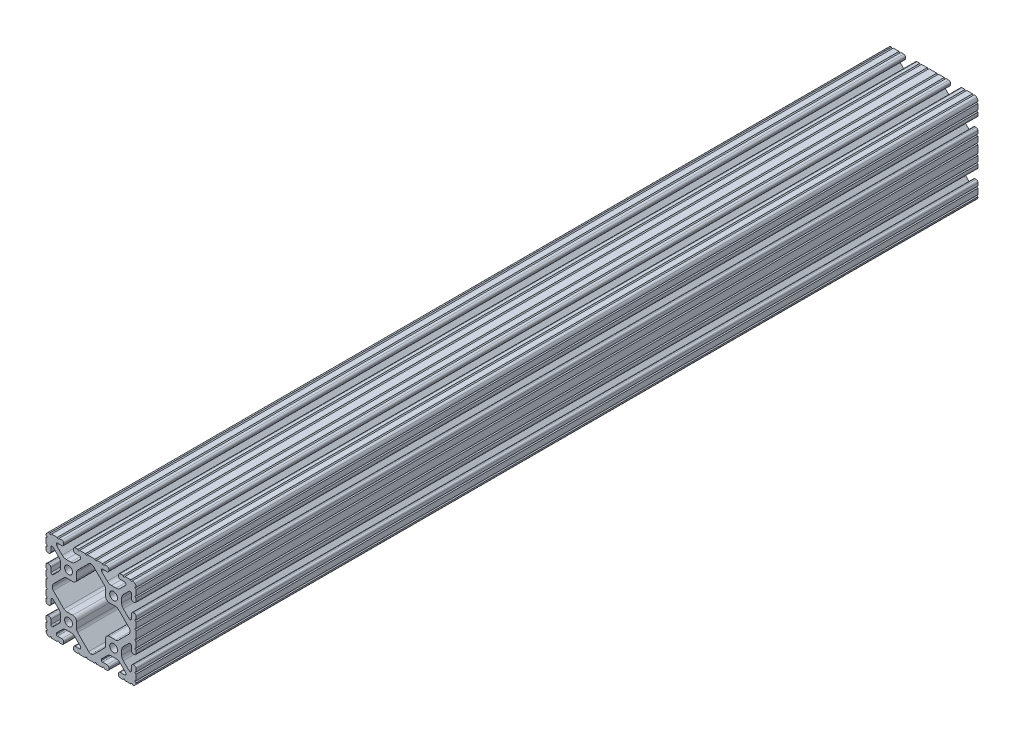
from build123d import *

# Parameters (mm, degrees)
BOSS_EXTRUDE1_DEPTH      = 355.6
BOSS_EXTRUDE1_DEPTH_BACK = 355.6
SKETCH3_R                = 3.3274


with BuildPart() as part:
    # Sketch3 → Boss-Extrude1 (new, two sides: drawn at the far end of the back side and taken through both)
    with BuildSketch(Plane.XY.offset(-BOSS_EXTRUDE1_DEPTH_BACK)):
        with BuildLine():
            Line((34.036, 28.448), (34.036, 24.630196049))
            ThreePointArc((34.036, 24.630196049), (34.497248241, 23.51664429), (35.6108, 23.055396049))
            Line((35.6108, 23.055396049), (36.525200183, 23.055396049))
            ThreePointArc((36.525200183, 23.055396049), (37.638751813, 23.516644236), (38.1, 24.630195866))
            Line((38.1, 24.630195866), (38.1, 27.023826138))
            ThreePointArc((38.1, 27.023826138), (37.117780706, 27.7845421), (38.1, 28.545258062))
            Line((38.1, 28.545258062), (38.1, 33.373016026))
            ThreePointArc((38.1, 33.373016026), (37.141472621, 34.109236774), (38.1, 34.845457521))
            ThreePointArc((38.1, 34.845457521), (37.837757813, 36.120195002), (37.086123144, 37.182631793))
            ThreePointArc((37.086123144, 37.182631793), (36.106286572, 37.843374398), (34.952681874, 38.1))
            ThreePointArc((34.952681874, 38.1), (34.190730434, 37.320215335), (33.428778994, 38.1))
            Line((33.428778994, 38.1), (28.601105935, 38.1))
            ThreePointArc((28.601105935, 38.1), (27.839158581, 37.32021942), (27.077211227, 38.1))
            Line((27.077211227, 38.1), (24.6888, 38.1))
            ThreePointArc((24.6888, 38.1), (23.575248241, 37.638751759), (23.114, 36.5252))
            Line((23.114, 36.5252), (23.114, 35.6108))
            ThreePointArc((23.114, 35.6108), (23.575248241, 34.497248241), (24.6888, 34.036))
            Line((24.6888, 34.036), (28.448, 34.036))
            ThreePointArc((28.448, 34.036), (29.076617928, 33.775617928), (29.337, 33.147))
            Line((29.337, 33.147), (29.337, 32.720693454))
            ThreePointArc((29.337, 32.720693454), (29.326675076, 32.273872751), (29.100231244, 31.888543625))
            Line((29.100231244, 31.888543625), (24.409287499, 27.197588341))
            ThreePointArc((24.409287499, 27.197588341), (22.868340045, 26.167958114), (21.050667579, 25.8064))
            Line((21.050667579, 25.8064), (17.049332421, 25.8064))
            ThreePointArc((17.049332421, 25.8064), (15.231659955, 26.167958114), (13.690712501, 27.197588341))
            Line((13.690712501, 27.197588341), (9.023381298, 31.864931024))
            ThreePointArc((9.023381298, 31.864931024), (8.830670886, 32.153343113), (8.763, 32.493548179))
            Line((8.763, 32.493548179), (8.763, 33.147))
            ThreePointArc((8.763, 33.147), (9.023382072, 33.775617928), (9.652, 34.036))
            Line((9.652, 34.036), (13.4112, 34.036))
            ThreePointArc((13.4112, 34.036), (14.524751759, 34.497248241), (14.986, 35.6108))
            Line((14.986, 35.6108), (14.986, 36.5252))
            ThreePointArc((14.986, 36.5252), (14.524751759, 37.638751759), (13.4112, 38.1))
            Line((13.4112, 38.1), (11.128867074, 38.1))
            ThreePointArc((11.128867074, 38.1), (10.367071033, 37.320370693), (9.605274992, 38.1))
            Line((9.605274992, 38.1), (4.777313069, 38.1))
            ThreePointArc((4.777313069, 38.1), (4.015517029, 37.320370693), (3.253720988, 38.1))
            Line((3.253720988, 38.1), (-3.253720988, 38.1))
            ThreePointArc((-3.253720988, 38.1), (-4.015517029, 37.320370693), (-4.777313069, 38.1))
            Line((-4.777313069, 38.1), (-9.605274992, 38.1))
            ThreePointArc((-9.605274992, 38.1), (-10.367071033, 37.320370693), (-11.128867074, 38.1))
            Line((-11.128867074, 38.1), (-13.4112, 38.1))
            ThreePointArc((-13.4112, 38.1), (-14.524751759, 37.638751759), (-14.986, 36.5252))
            Line((-14.986, 36.5252), (-14.986, 35.6108))
            ThreePointArc((-14.986, 35.6108), (-14.524751759, 34.497248241), (-13.4112, 34.036))
            Line((-13.4112, 34.036), (-9.652, 34.036))
            ThreePointArc((-9.652, 34.036), (-9.023382072, 33.775617928), (-8.763, 33.147))
            Line((-8.763, 33.147), (-8.763, 32.493548179))
            ThreePointArc((-8.763, 32.493548179), (-8.830670886, 32.153343113), (-9.023381298, 31.864931024))
            Line((-9.023381298, 31.864931024), (-13.690712501, 27.197588341))
            ThreePointArc((-13.690712501, 27.197588341), (-15.231659955, 26.167958114), (-17.049332421, 25.8064))
            Line((-17.049332421, 25.8064), (-21.050667579, 25.8064))
            ThreePointArc((-21.050667579, 25.8064), (-22.868340045, 26.167958114), (-24.409287499, 27.197588341))
            Line((-24.409287499, 27.197588341), (-29.100231244, 31.888543625))
            ThreePointArc((-29.100231244, 31.888543625), (-29.326675076, 32.273872751), (-29.337, 32.720693454))
            Line((-29.337, 32.720693454), (-29.337, 33.147))
            ThreePointArc((-29.337, 33.147), (-29.076617928, 33.775617928), (-28.448, 34.036))
            Line((-28.448, 34.036), (-24.6888, 34.036))
            ThreePointArc((-24.6888, 34.036), (-23.575248241, 34.497248241), (-23.114, 35.6108))
            Line((-23.114, 35.6108), (-23.114, 36.5252))
            ThreePointArc((-23.114, 36.5252), (-23.575248241, 37.638751759), (-24.6888, 38.1))
            Line((-24.6888, 38.1), (-27.077211227, 38.1))
            ThreePointArc((-27.077211227, 38.1), (-27.839158581, 37.32021942), (-28.601105935, 38.1))
            Line((-28.601105935, 38.1), (-33.428778994, 38.1))
            ThreePointArc((-33.428778994, 38.1), (-34.190730434, 37.320215335), (-34.952681874, 38.1))
            ThreePointArc((-34.952681874, 38.1), (-36.106286572, 37.843374398), (-37.086123144, 37.182631793))
            ThreePointArc((-37.086123144, 37.182631793), (-37.837757813, 36.120195002), (-38.1, 34.845457521))
            ThreePointArc((-38.1, 34.845457521), (-37.141472621, 34.109236774), (-38.1, 33.373016026))
            Line((-38.1, 33.373016026), (-38.1, 28.545258062))
            ThreePointArc((-38.1, 28.545258062), (-37.117780706, 27.7845421), (-38.1, 27.023826138))
            Line((-38.1, 27.023826138), (-38.1, 24.630195866))
            ThreePointArc((-38.1, 24.630195866), (-37.638751813, 23.516644236), (-36.525200183, 23.055396049))
            Line((-36.525200183, 23.055396049), (-35.6108, 23.055396049))
            ThreePointArc((-35.6108, 23.055396049), (-34.497248241, 23.51664429), (-34.036, 24.630196049))
            Line((-34.036, 24.630196049), (-34.036, 28.448))
            ThreePointArc((-34.036, 28.448), (-33.775617928, 29.076617928), (-33.147, 29.337))
            Line((-33.147, 29.337), (-32.664287242, 29.337))
            ThreePointArc((-32.664287242, 29.337), (-32.324081166, 29.269328695), (-32.03566854, 29.076617155))
            Line((-32.03566854, 29.076617155), (-27.19758008, 24.238516795))
            ThreePointArc((-27.19758008, 24.238516795), (-26.167955879, 22.697572205), (-25.8064, 20.879905136))
            Line((-25.8064, 20.879905136), (-25.8064, 17.220094864))
            ThreePointArc((-25.8064, 17.220094864), (-26.167955879, 15.402427795), (-27.19758008, 13.861483205))
            Line((-27.19758008, 13.861483205), (-31.948944541, 9.110107057))
            ThreePointArc((-31.948944541, 9.110107057), (-32.333417096, 8.853210196), (-32.786933649, 8.763))
            Line((-32.786933649, 8.763), (-33.060275787, 8.763))
            ThreePointArc((-33.060275787, 8.763), (-33.750216995, 9.048783005), (-34.036, 9.738724213))
            Line((-34.036, 9.738724213), (-34.036, 13.469803585))
            ThreePointArc((-34.036, 13.469803585), (-34.497248348, 14.583355603), (-35.610800366, 15.044603951))
            Line((-35.610800366, 15.044603951), (-36.5252, 15.044603951))
            ThreePointArc((-36.5252, 15.044603951), (-37.638751759, 14.58335571), (-38.1, 13.469803951))
            Line((-38.1, 13.469803951), (-38.1, 11.075039289))
            ThreePointArc((-38.1, 11.075039289), (-37.117000248, 10.313517272), (-38.1, 9.551995255))
            Line((-38.1, 9.551995255), (-38.1, 4.723759308))
            ThreePointArc((-38.1, 4.723759308), (-37.117000248, 3.962237292), (-38.1, 3.200715275))
            Line((-38.1, 3.200715275), (-38.1, -3.200715275))
            ThreePointArc((-38.1, -3.200715275), (-37.117000248, -3.962237292), (-38.1, -4.723759308))
            Line((-38.1, -4.723759308), (-38.1, -9.551995255))
            ThreePointArc((-38.1, -9.551995255), (-37.117000248, -10.313517272), (-38.1, -11.075039289))
            Line((-38.1, -11.075039289), (-38.1, -13.469803951))
            ThreePointArc((-38.1, -13.469803951), (-37.638751759, -14.58335571), (-36.5252, -15.044603951))
            Line((-36.5252, -15.044603951), (-35.610800366, -15.044603951))
            ThreePointArc((-35.610800366, -15.044603951), (-34.497248348, -14.583355603), (-34.036, -13.469803585))
            Line((-34.036, -13.469803585), (-34.036, -9.738724213))
            ThreePointArc((-34.036, -9.738724213), (-33.750216995, -9.048783005), (-33.060275787, -8.763))
            Line((-33.060275787, -8.763), (-32.786933649, -8.763))
            ThreePointArc((-32.786933649, -8.763), (-32.333417096, -8.853210196), (-31.948944541, -9.110107057))
            Line((-31.948944541, -9.110107057), (-27.19758008, -13.861483205))
            ThreePointArc((-27.19758008, -13.861483205), (-26.167955879, -15.402427795), (-25.8064, -17.220094864))
            Line((-25.8064, -17.220094864), (-25.8064, -20.879905136))
            ThreePointArc((-25.8064, -20.879905136), (-26.167955879, -22.697572205), (-27.19758008, -24.238516795))
            Line((-27.19758008, -24.238516795), (-32.03566854, -29.076617155))
            ThreePointArc((-32.03566854, -29.076617155), (-32.324081166, -29.269328695), (-32.664287242, -29.337))
            Line((-32.664287242, -29.337), (-33.147, -29.337))
            ThreePointArc((-33.147, -29.337), (-33.775617928, -29.076617928), (-34.036, -28.448))
            Line((-34.036, -28.448), (-34.036, -24.630196049))
            ThreePointArc((-34.036, -24.630196049), (-34.497248241, -23.51664429), (-35.6108, -23.055396049))
            Line((-35.6108, -23.055396049), (-36.525200183, -23.055396049))
            ThreePointArc((-36.525200183, -23.055396049), (-37.638751813, -23.516644236), (-38.1, -24.630195866))
            Line((-38.1, -24.630195866), (-38.1, -27.023826138))
            ThreePointArc((-38.1, -27.023826138), (-37.117780706, -27.7845421), (-38.1, -28.545258062))
            Line((-38.1, -28.545258062), (-38.1, -33.373016026))
            ThreePointArc((-38.1, -33.373016026), (-37.141472621, -34.109236774), (-38.1, -34.845457521))
            ThreePointArc((-38.1, -34.845457521), (-37.837757813, -36.120195002), (-37.086123144, -37.182631793))
            ThreePointArc((-37.086123144, -37.182631793), (-36.106286572, -37.843374398), (-34.952681874, -38.1))
            ThreePointArc((-34.952681874, -38.1), (-34.190730434, -37.320215335), (-33.428778994, -38.1))
            Line((-33.428778994, -38.1), (-28.601105935, -38.1))
            ThreePointArc((-28.601105935, -38.1), (-27.839158581, -37.32021942), (-27.077211227, -38.1))
            Line((-27.077211227, -38.1), (-24.6888, -38.1))
            ThreePointArc((-24.6888, -38.1), (-23.575248241, -37.638751759), (-23.114, -36.5252))
            Line((-23.114, -36.5252), (-23.114, -35.6108))
            ThreePointArc((-23.114, -35.6108), (-23.575248241, -34.497248241), (-24.6888, -34.036))
            Line((-24.6888, -34.036), (-28.448, -34.036))
            ThreePointArc((-28.448, -34.036), (-29.076617928, -33.775617928), (-29.337, -33.147))
            Line((-29.337, -33.147), (-29.337, -32.720693454))
            ThreePointArc((-29.337, -32.720693454), (-29.326675076, -32.273872751), (-29.100231244, -31.888543625))
            Line((-29.100231244, -31.888543625), (-24.409287499, -27.197588341))
            ThreePointArc((-24.409287499, -27.197588341), (-22.868340045, -26.167958114), (-21.050667579, -25.8064))
            Line((-21.050667579, -25.8064), (-17.049332421, -25.8064))
            ThreePointArc((-17.049332421, -25.8064), (-15.231659955, -26.167958114), (-13.690712501, -27.197588341))
            Line((-13.690712501, -27.197588341), (-9.023381298, -31.864931024))
            ThreePointArc((-9.023381298, -31.864931024), (-8.830670886, -32.153343113), (-8.763, -32.493548179))
            Line((-8.763, -32.493548179), (-8.763, -33.147))
            ThreePointArc((-8.763, -33.147), (-9.023382072, -33.775617928), (-9.652, -34.036))
            Line((-9.652, -34.036), (-13.4112, -34.036))
            ThreePointArc((-13.4112, -34.036), (-14.524751759, -34.497248241), (-14.986, -35.6108))
            Line((-14.986, -35.6108), (-14.986, -36.5252))
            ThreePointArc((-14.986, -36.5252), (-14.524751759, -37.638751759), (-13.4112, -38.1))
            Line((-13.4112, -38.1), (-11.128867074, -38.1))
            ThreePointArc((-11.128867074, -38.1), (-10.367071033, -37.320370693), (-9.605274992, -38.1))
            Line((-9.605274992, -38.1), (-4.777313069, -38.1))
            ThreePointArc((-4.777313069, -38.1), (-4.015517029, -37.320370693), (-3.253720988, -38.1))
            Line((-3.253720988, -38.1), (3.253720988, -38.1))
            ThreePointArc((3.253720988, -38.1), (4.015517029, -37.320370693), (4.777313069, -38.1))
            Line((4.777313069, -38.1), (9.605274992, -38.1))
            ThreePointArc((9.605274992, -38.1), (10.367071033, -37.320370693), (11.128867074, -38.1))
            Line((11.128867074, -38.1), (13.4112, -38.1))
            ThreePointArc((13.4112, -38.1), (14.524751759, -37.638751759), (14.986, -36.5252))
            Line((14.986, -36.5252), (14.986, -35.6108))
            ThreePointArc((14.986, -35.6108), (14.524751759, -34.497248241), (13.4112, -34.036))
            Line((13.4112, -34.036), (9.652, -34.036))
            ThreePointArc((9.652, -34.036), (9.023382072, -33.775617928), (8.763, -33.147))
            Line((8.763, -33.147), (8.763, -32.493548179))
            ThreePointArc((8.763, -32.493548179), (8.830670886, -32.153343113), (9.023381298, -31.864931024))
            Line((9.023381298, -31.864931024), (13.690712501, -27.197588341))
            ThreePointArc((13.690712501, -27.197588341), (15.231659955, -26.167958114), (17.049332421, -25.8064))
            Line((17.049332421, -25.8064), (21.050667579, -25.8064))
            ThreePointArc((21.050667579, -25.8064), (22.868340045, -26.167958114), (24.409287499, -27.197588341))
            Line((24.409287499, -27.197588341), (29.100231244, -31.888543625))
            ThreePointArc((29.100231244, -31.888543625), (29.326675076, -32.273872751), (29.337, -32.720693454))
            Line((29.337, -32.720693454), (29.337, -33.147))
            ThreePointArc((29.337, -33.147), (29.076617928, -33.775617928), (28.448, -34.036))
            Line((28.448, -34.036), (24.6888, -34.036))
            ThreePointArc((24.6888, -34.036), (23.575248241, -34.497248241), (23.114, -35.6108))
            Line((23.114, -35.6108), (23.114, -36.5252))
            ThreePointArc((23.114, -36.5252), (23.575248241, -37.638751759), (24.6888, -38.1))
            Line((24.6888, -38.1), (27.077211227, -38.1))
            ThreePointArc((27.077211227, -38.1), (27.839158581, -37.32021942), (28.601105935, -38.1))
            Line((28.601105935, -38.1), (33.428778994, -38.1))
            ThreePointArc((33.428778994, -38.1), (34.190730434, -37.320215335), (34.952681874, -38.1))
            ThreePointArc((34.952681874, -38.1), (36.106286572, -37.843374398), (37.086123144, -37.182631793))
            ThreePointArc((37.086123144, -37.182631793), (37.837757813, -36.120195002), (38.1, -34.845457521))
            ThreePointArc((38.1, -34.845457521), (37.141472621, -34.109236774), (38.1, -33.373016026))
            Line((38.1, -33.373016026), (38.1, -28.545258062))
            ThreePointArc((38.1, -28.545258062), (37.117780706, -27.7845421), (38.1, -27.023826138))
            Line((38.1, -27.023826138), (38.1, -24.630195866))
            ThreePointArc((38.1, -24.630195866), (37.638751813, -23.516644236), (36.525200183, -23.055396049))
            Line((36.525200183, -23.055396049), (35.6108, -23.055396049))
            ThreePointArc((35.6108, -23.055396049), (34.497248241, -23.51664429), (34.036, -24.630196049))
            Line((34.036, -24.630196049), (34.036, -28.448))
            ThreePointArc((34.036, -28.448), (33.775617928, -29.076617928), (33.147, -29.337))
            Line((33.147, -29.337), (32.664287242, -29.337))
            ThreePointArc((32.664287242, -29.337), (32.324081166, -29.269328695), (32.03566854, -29.076617155))
            Line((32.03566854, -29.076617155), (27.19758008, -24.238516795))
            ThreePointArc((27.19758008, -24.238516795), (26.167955879, -22.697572205), (25.8064, -20.879905136))
            Line((25.8064, -20.879905136), (25.8064, -17.220094864))
            ThreePointArc((25.8064, -17.220094864), (26.167955879, -15.402427795), (27.19758008, -13.861483205))
            Line((27.19758008, -13.861483205), (31.948944541, -9.110107057))
            ThreePointArc((31.948944541, -9.110107057), (32.333417096, -8.853210196), (32.786933649, -8.763))
            Line((32.786933649, -8.763), (33.060275787, -8.763))
            ThreePointArc((33.060275787, -8.763), (33.750216995, -9.048783005), (34.036, -9.738724213))
            Line((34.036, -9.738724213), (34.036, -13.469803585))
            ThreePointArc((34.036, -13.469803585), (34.497248348, -14.583355603), (35.610800366, -15.044603951))
            Line((35.610800366, -15.044603951), (36.5252, -15.044603951))
            ThreePointArc((36.5252, -15.044603951), (37.638751759, -14.58335571), (38.1, -13.469803951))
            Line((38.1, -13.469803951), (38.1, -11.075039289))
            ThreePointArc((38.1, -11.075039289), (37.117000248, -10.313517272), (38.1, -9.551995255))
            Line((38.1, -9.551995255), (38.1, -4.723759308))
            ThreePointArc((38.1, -4.723759308), (37.117000248, -3.962237292), (38.1, -3.200715275))
            Line((38.1, -3.200715275), (38.1, 3.200715275))
            ThreePointArc((38.1, 3.200715275), (37.117000248, 3.962237292), (38.1, 4.723759308))
            Line((38.1, 4.723759308), (38.1, 9.551995255))
            ThreePointArc((38.1, 9.551995255), (37.117000248, 10.313517272), (38.1, 11.075039289))
            Line((38.1, 11.075039289), (38.1, 13.469803951))
            ThreePointArc((38.1, 13.469803951), (37.638751759, 14.58335571), (36.5252, 15.044603951))
            Line((36.5252, 15.044603951), (35.610800366, 15.044603951))
            ThreePointArc((35.610800366, 15.044603951), (34.497248348, 14.583355603), (34.036, 13.469803585))
            Line((34.036, 13.469803585), (34.036, 9.738724213))
            ThreePointArc((34.036, 9.738724213), (33.750216995, 9.048783005), (33.060275787, 8.763))
            Line((33.060275787, 8.763), (32.786933649, 8.763))
            ThreePointArc((32.786933649, 8.763), (32.333417096, 8.853210196), (31.948944541, 9.110107057))
            Line((31.948944541, 9.110107057), (27.19758008, 13.861483205))
            ThreePointArc((27.19758008, 13.861483205), (26.167955879, 15.402427795), (25.8064, 17.220094864))
            Line((25.8064, 17.220094864), (25.8064, 20.879905136))
            ThreePointArc((25.8064, 20.879905136), (26.167955879, 22.697572205), (27.19758008, 24.238516795))
            Line((27.19758008, 24.238516795), (32.03566854, 29.076617155))
            ThreePointArc((32.03566854, 29.076617155), (32.324081166, 29.269328695), (32.664287242, 29.337))
            Line((32.664287242, 29.337), (33.147, 29.337))
            ThreePointArc((33.147, 29.337), (33.775617928, 29.076617928), (34.036, 28.448))
        make_face()
        with Locations((19.05, 19.05)):
            Circle(SKETCH3_R, mode=Mode.SUBTRACT)
        with Locations((-19.05, 19.05)):
            Circle(SKETCH3_R, mode=Mode.SUBTRACT)
        with Locations((19.05, -19.05)):
            Circle(SKETCH3_R, mode=Mode.SUBTRACT)
        with Locations((-19.05, -19.05)):
            Circle(SKETCH3_R, mode=Mode.SUBTRACT)
        with BuildLine():
            Line((-11.363666791, -22.843321003), (-2.051515952, -32.155494748))
            ThreePointArc((-2.051515952, -32.155494748), (-1.11031328, -32.786013752), (0, -33.011005091))
            ThreePointArc((0, -33.011005091), (1.11031328, -32.786013752), (2.051515952, -32.155494748))
            Line((2.051515952, -32.155494748), (11.363666791, -22.843321003))
            ThreePointArc((11.363666791, -22.843321003), (12.051918263, -21.813277828), (12.2936, -20.598259734))
            Line((12.2936, -20.598259734), (12.2936, -15.4686))
            ThreePointArc((12.2936, -15.4686), (13.22353597, -13.22353597), (15.4686, -12.2936))
            Line((15.4686, -12.2936), (20.769026744, -12.2936))
            ThreePointArc((20.769026744, -12.2936), (21.984048446, -12.051916769), (23.014093535, -11.363661269))
            Line((23.014093535, -11.363661269), (31.902125566, -2.475607377))
            ThreePointArc((31.902125566, -2.475607377), (32.607298578, -1.335259481), (32.728725173, 0))
            ThreePointArc((32.728725173, 0), (32.607298578, 1.335259481), (31.902125566, 2.475607377))
            Line((31.902125566, 2.475607377), (23.014093535, 11.363661269))
            ThreePointArc((23.014093535, 11.363661269), (21.984048446, 12.051916769), (20.769026744, 12.2936))
            Line((20.769026744, 12.2936), (15.4686, 12.2936))
            ThreePointArc((15.4686, 12.2936), (13.22353597, 13.22353597), (12.2936, 15.4686))
            Line((12.2936, 15.4686), (12.2936, 20.598259734))
            ThreePointArc((12.2936, 20.598259734), (12.051918263, 21.813277828), (11.363666791, 22.843321003))
            Line((11.363666791, 22.843321003), (2.051515952, 32.155494748))
            ThreePointArc((2.051515952, 32.155494748), (1.11031328, 32.786013752), (0, 33.011005091))
            ThreePointArc((0, 33.011005091), (-1.11031328, 32.786013752), (-2.051515952, 32.155494748))
            Line((-2.051515952, 32.155494748), (-11.363666791, 22.843321003))
            ThreePointArc((-11.363666791, 22.843321003), (-12.051918263, 21.813277828), (-12.2936, 20.598259734))
            Line((-12.2936, 20.598259734), (-12.2936, 15.4686))
            ThreePointArc((-12.2936, 15.4686), (-13.22353597, 13.22353597), (-15.4686, 12.2936))
            Line((-15.4686, 12.2936), (-20.769026744, 12.2936))
            ThreePointArc((-20.769026744, 12.2936), (-21.984048446, 12.051916769), (-23.014093535, 11.363661269))
            Line((-23.014093535, 11.363661269), (-31.902125566, 2.475607377))
            ThreePointArc((-31.902125566, 2.475607377), (-32.607298578, 1.335259481), (-32.728725173, 0))
            ThreePointArc((-32.728725173, 0), (-32.607298578, -1.335259481), (-31.902125566, -2.475607377))
            Line((-31.902125566, -2.475607377), (-23.014093535, -11.363661269))
            ThreePointArc((-23.014093535, -11.363661269), (-21.984048446, -12.051916769), (-20.769026744, -12.2936))
            Line((-20.769026744, -12.2936), (-15.4686, -12.2936))
            ThreePointArc((-15.4686, -12.2936), (-13.22353597, -13.22353597), (-12.2936, -15.4686))
            Line((-12.2936, -15.4686), (-12.2936, -20.598259734))
            ThreePointArc((-12.2936, -20.598259734), (-12.051918263, -21.813277828), (-11.363666791, -22.843321003))
        make_face(mode=Mode.SUBTRACT)
    extrude(amount=BOSS_EXTRUDE1_DEPTH + BOSS_EXTRUDE1_DEPTH_BACK)


solid = part.part
